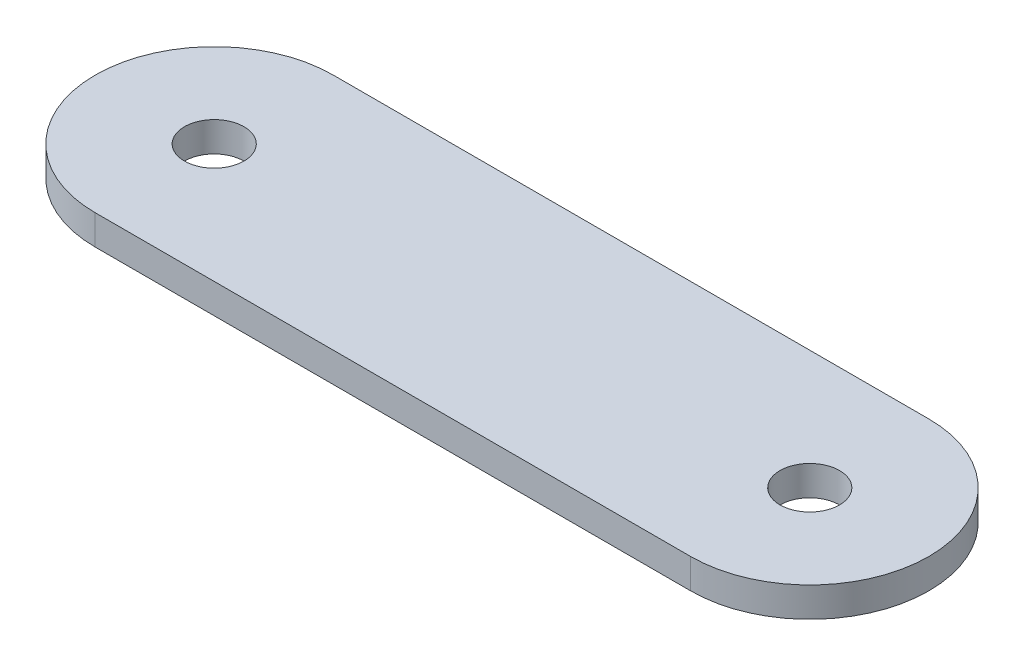
from build123d import *

# Parameters (mm, degrees)
SKETCH1_R           = 1.5875
BOSS_EXTRUDE1_DEPTH = 1.5875


with BuildPart() as part:
    # Sketch1 → Boss-Extrude1 (new body)
    with BuildSketch(Plane(origin=(0, 0, 0), x_dir=(1, 0, 0), z_dir=(0, 1, 0))):
        with BuildLine():
            Line((15.875, -6.35), (-15.875, -6.35))
            ThreePointArc((-15.875, -6.35), (-22.225, 0), (-15.875, 6.35))
            Line((-15.875, 6.35), (15.875, 6.35))
            ThreePointArc((15.875, 6.35), (22.225, 0), (15.875, -6.35))
        make_face()
        with Locations(Location((-15.875, 0, 0), (0, 0, 270))):
            Circle(SKETCH1_R, mode=Mode.SUBTRACT)
        with Locations(Location((15.875, 0, 0), (0, 0, 270))):
            Circle(SKETCH1_R, mode=Mode.SUBTRACT)
    extrude(amount=BOSS_EXTRUDE1_DEPTH)


solid = part.part
